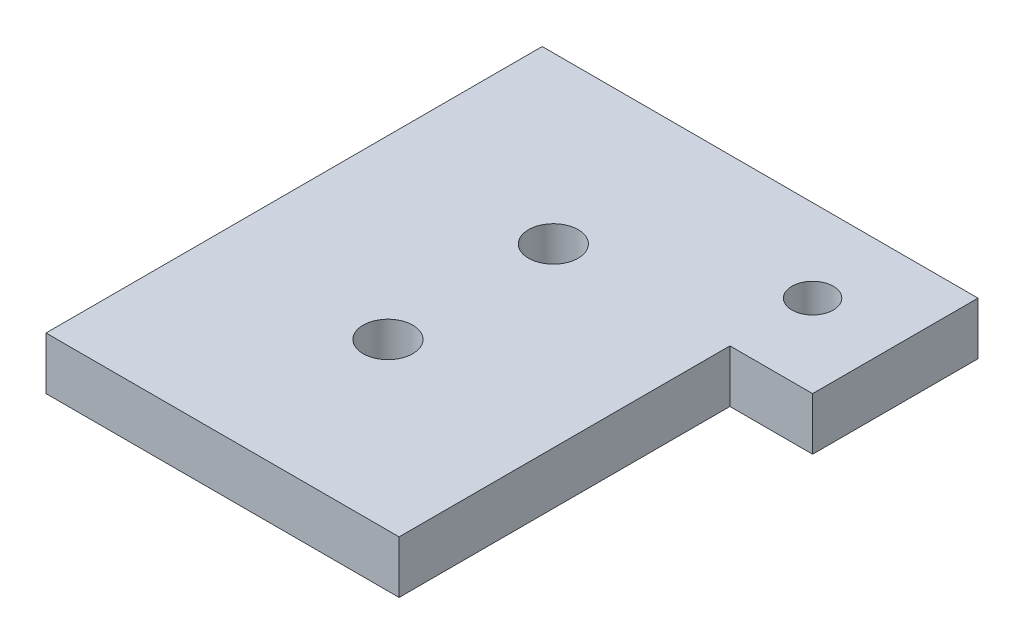
from build123d import *

# Parameters (mm, degrees)
SKETCH1_R           = 1.25
SKETCH1_R_2         = 1.5
BOSS_EXTRUDE1_DEPTH = 3.175


with BuildPart() as part:
    # Sketch1 → Boss-Extrude1 (new body)
    with BuildSketch(Plane(origin=(0, 0, 0), x_dir=(1, 0, 0), z_dir=(0, 1, 0))):
        Polygon((0, 0), (10.675, 0), (21.35, 0), (21.35, 20), (26.35, 20), (26.35, 30), (0, 30), align=None)
        with Locations((21.35, 25)):
            Circle(SKETCH1_R, mode=Mode.SUBTRACT)
        with BuildLine():
            ThreePointArc((10.675, 8.5), (9.175, 10), (10.675, 11.5))
            ThreePointArc((10.675, 11.5), (12.175, 10), (10.675, 8.5))
        make_face(mode=Mode.SUBTRACT)
        with Locations((10.675, 20)):
            Circle(SKETCH1_R_2, mode=Mode.SUBTRACT)
    extrude(amount=BOSS_EXTRUDE1_DEPTH)


solid = part.part
